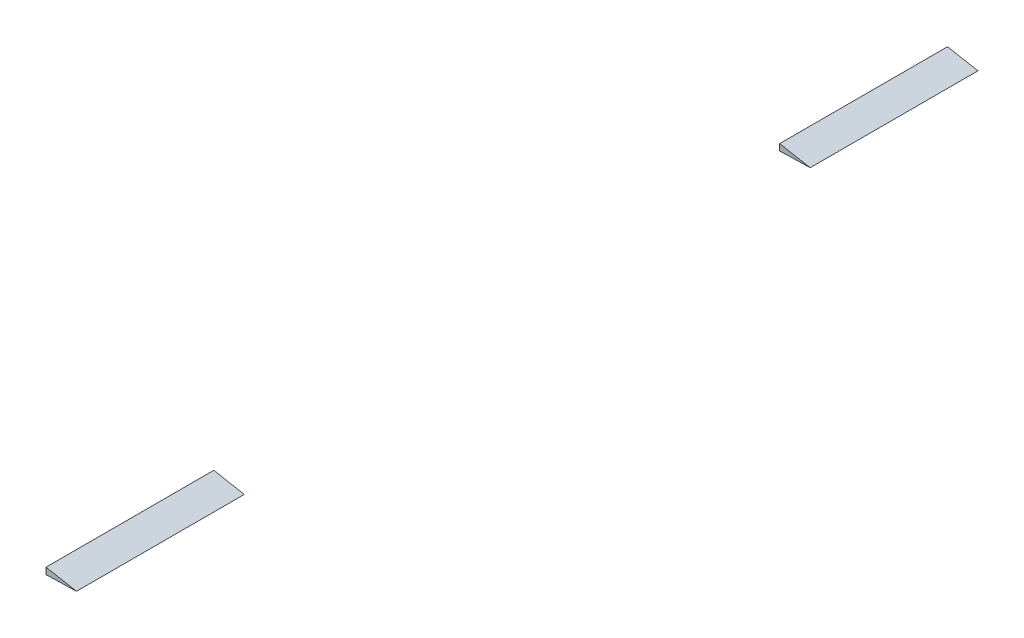
from build123d import *

# Parameters (mm, degrees)
BOSS_EXTRUDE1_DEPTH     = 875
CUT_EXTRUDE1_DEPTH      = 881.879454843
CUT_EXTRUDE1_DEPTH_BACK = 881.879454843


with BuildPart() as part:
    # Sketch1 → Boss-Extrude1 (new, symmetric)
    with BuildSketch(Plane.XY):
        with BuildLine():
            add(Edge.make_bspline(
                [(100.91824287, -5.70312156), (100.917928302, -5.691984058), (100.103872555, -5.623522289), (99.280592479, -5.464574379), (97.301838761, -5.167293181), (94.893792204, -4.740313208), (91.763418033, -4.194020721), (88.075779131, -3.527092424), (83.82586832, -2.733839889), (79.07466539, -1.829159833), (73.868292655, -0.815261424), (68.257586758, 0.28149671), (62.297699244, 1.44772436), (56.040627516, 2.659541325), (49.522304418, 3.863298421), (42.776163339, 5.024182063), (35.842465214, 6.159362695), (28.754894986, 7.225237491), (21.557088168, 8.212036363), (14.289938921, 9.11702244), (6.986491581, 9.896502104), (-0.312291465, 10.567439736), (-7.573250933, 11.101452566), (-14.756788427, 11.484472196), (-21.829214216, 11.73432499), (-28.756354515, 11.821009192), (-35.503522333, 11.750617393), (-42.039927215, 11.528099679), (-48.337618053, 11.139668586), (-54.368823591, 10.599316119), (-60.107813763, 9.916065983), (-65.5246312, 9.082841334), (-70.600710971, 8.133580398), (-75.312124387, 7.06030936), (-79.639012678, 5.882400605), (-83.565794194, 4.620592947), (-87.074573399, 3.286478994), (-90.155255222, 1.908430123), (-92.7947781, 0.504611279), (-94.983077923, -0.904381491), (-96.712918902, -2.27019758), (-98.000485425, -3.580792759), (-98.761905736, -4.743195836), (-99.230109063, -5.858193724), (-98.606025292, -6.870082158), (-97.444377041, -7.545330585), (-95.746709082, -8.188615648), (-93.444858666, -8.65302005), (-90.532849186, -8.981809806), (-87.012786058, -9.249938029), (-82.906631066, -9.471230862), (-78.240220774, -9.591108348), (-73.047587861, -9.700035936), (-67.364458994, -9.726825212), (-61.232945666, -9.735598818), (-54.695580066, -9.663971329), (-47.787860167, -9.57405054), (-40.547660449, -9.399905225), (-33.014906842, -9.224168897), (-25.241541211, -9.024405524), (-17.28179212, -8.801970667), (-9.194124895, -8.575484575), (-1.034753503, -8.389600976), (7.134931724, -8.163914261), (15.261915306, -7.937211966), (23.292019947, -7.753265877), (31.171989128, -7.520412865), (38.853338861, -7.320323338), (46.282726984, -7.155039977), (53.396722649, -6.942825345), (60.134764376, -6.764425726), (66.461797873, -6.610760114), (72.370019545, -6.444067915), (77.851690837, -6.304693879), (82.870292529, -6.189451934), (87.37297449, -6.074184551), (91.286636897, -5.943657403), (94.610580102, -5.86381881), (97.158504539, -5.820700532), (99.231452991, -5.738256396), (100.085997803, -5.733999914), (100.918560502, -5.714367546), (100.91824287, -5.70312156)],
                knots=[0, 0, 0, 0, 0.000950607, 0.003756507, 0.008317118, 0.014521534, 0.022293258, 0.031559824, 0.042220752, 0.054150955, 0.067231026, 0.081331038, 0.096307423, 0.112011952, 0.128327294, 0.145184499, 0.162487629, 0.180135525, 0.198033488, 0.216058829, 0.234134495, 0.252191782, 0.270104077, 0.287817033, 0.305234681, 0.322284448, 0.338896329, 0.354986109, 0.370505848, 0.385416956, 0.399632136, 0.413115968, 0.42582253, 0.437703697, 0.448737409, 0.458879724, 0.468105333, 0.476404612, 0.483748471, 0.49013386, 0.495557186, 0.500011534, 0.503516098, 0.506001286, 0.508215361, 0.511493607, 0.515843652, 0.521547383, 0.528754592, 0.537448665, 0.547575188, 0.55907379, 0.571867409, 0.585873248, 0.600979911, 0.617080267, 0.634081341, 0.651920682, 0.670483603, 0.689642387, 0.709259499, 0.729200941, 0.749303287, 0.769441295, 0.789466278, 0.8092541, 0.828669736, 0.847597548, 0.865914743, 0.883466594, 0.900078509, 0.915617835, 0.930134998, 0.943663107, 0.956049855, 0.967158865, 0.976852657, 0.984995817, 0.991471781, 0.996183553, 0.999040133, 1, 1, 1, 1], degree=3))
        make_face()
    extrude(amount=BOSS_EXTRUDE1_DEPTH, both=True)

    # Sketch3 → Cut-Extrude1 (cut, two sides: drawn at the far end of the back side and taken through both)
    with BuildSketch(Plane(origin=(0, 0, 0), x_dir=(1, 0, 0), z_dir=(0, 1, 0)).offset(-CUT_EXTRUDE1_DEPTH_BACK)):
        Polygon((100.918243231, 835.9), (44.370126982, 835.9), (44.370126982, 524.707472239), (100.918243231, 524.707472239), (100.918243231, -524.707472239), (44.370126982, -524.707472239), (44.370126982, -835.9), (100.918243231, -835.9), (100.918243231, -1428.407127824), (-134.13320566, -1428.407127824), (-134.13320566, 941.271454546), (100.918243231, 941.271454546), align=None)
    extrude(amount=CUT_EXTRUDE1_DEPTH + CUT_EXTRUDE1_DEPTH_BACK, mode=Mode.SUBTRACT)


with BuildPart() as cut_extrude1_piece_1:
    # of the separate pieces the step leaves, piece 1, a body of its own (cut_extrude1_pieces)
    add(part.part.solids().sort_by_distance((100.91824311, -5.703138592, 524.707472239))[0])


with BuildPart() as cut_extrude1_piece_2:
    # of the separate pieces the step leaves, piece 2, a body of its own (cut_extrude1_pieces)
    add(part.part.solids().sort_by_distance((44.370126982, 4.745424617, -524.707472239))[0])


solid = Compound([cut_extrude1_piece_1.part, cut_extrude1_piece_2.part])
